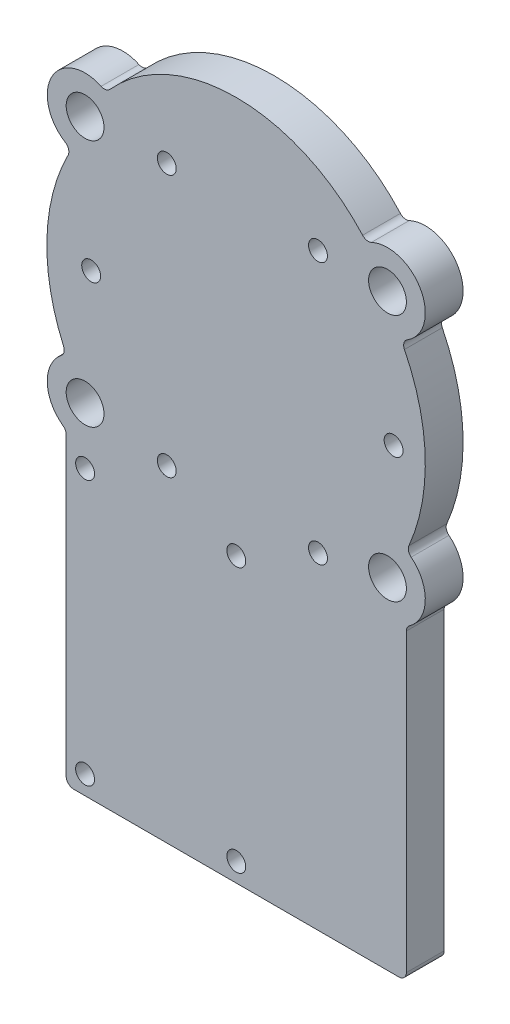
from build123d import *

# Parameters (mm, degrees)
SKETCH1_R           = 0.5
BOSS_EXTRUDE2_DEPTH = 1
FILLET2_R           = 0.2
SKETCH3_R           = 0.25
CUT_EXTRUDE1_DEPTH  = 1
SKETCH4_R           = 0.25
CUT_EXTRUDE2_DEPTH  = 1


with BuildPart() as part:
    # Sketch1 → Boss-Extrude2 (new body)
    with BuildSketch(Plane.XY):
        with BuildLine():
            Line((4.5, -9), (0, -9))
            Line((0, -9), (-4.5, -9))
            Line((-4.5, -9), (-4.5, -0.866025404))
            ThreePointArc((-4.5, -0.866025404), (-5, 0), (-4.5, 0.866025404))
            ThreePointArc((-4.5, 0.866025404), (-5.008977866, 3.264145238), (-4.356520714, 5.627265394))
            ThreePointArc((-4.356520714, 5.627265394), (-4.888888889, 7.01967566), (-3.445948422, 7.394035154))
            ThreePointArc((-3.445948422, 7.394035154), (0, 9), (3.445948422, 7.394035154))
            ThreePointArc((3.445948422, 7.394035154), (4.888888889, 7.01967566), (4.356520714, 5.627265394))
            ThreePointArc((4.356520714, 5.627265394), (4.997611441, 3.263802712), (4.5, 0.866025404))
            ThreePointArc((4.5, 0.866025404), (5, 0), (4.5, -0.866025404))
            Line((4.5, -0.866025404), (4.5, -9))
        make_face()
        with Locations((-4, 0)):
            Circle(SKETCH1_R, mode=Mode.SUBTRACT)
        with Locations((-4, 6.561552813)):
            Circle(SKETCH1_R, mode=Mode.SUBTRACT)
        with Locations(Location((4, 6.561552813, 0), (0, 0, 180))):
            Circle(SKETCH1_R, mode=Mode.SUBTRACT)
        with Locations(Location((4, 0, 0), (0, 0, 180))):
            Circle(SKETCH1_R, mode=Mode.SUBTRACT)
    extrude(amount=BOSS_EXTRUDE2_DEPTH)

    # Fillet2
    fillet2_edges = [part.edges().sort_by_distance(p)[0] for p in [
        (-4.5, -9, 0.5),
        (-4.5, -0.866025404, 0.5),
        (-4.5, 0.866025404, 0.5),
        (-4.356520714, 5.627265394, 0.5),
        (-3.445948422, 7.394035154, 0.5),
        (3.445948422, 7.394035154, 0.5),
        (4.356520714, 5.627265394, 0.5),
        (4.5, 0.866025404, 0.5),
        (4.5, -0.866025404, 0.5),
        (4.5, -9, 0.5),
    ]]
    fillet(fillet2_edges, radius=FILLET2_R)

    # Sketch3 → Cut-Extrude1 (cut)
    with BuildSketch(Plane(origin=(0, 0, 0), x_dir=(-1, 0, 0), z_dir=(0, 0, -1))):
        with Locations((3.839007705, 3.108348927)):
            Circle(SKETCH3_R)
        with Locations((1.839007705, -0.355752688)):
            Circle(SKETCH3_R)
        with Locations((-2.160992295, -0.355752688)):
            Circle(SKETCH3_R)
        with Locations((-4.160992295, 3.108348927)):
            Circle(SKETCH3_R)
        with Locations((-2.160992295, 6.572450542)):
            Circle(SKETCH3_R)
        with Locations((1.839007705, 6.572450542)):
            Circle(SKETCH3_R)
    extrude(amount=-CUT_EXTRUDE1_DEPTH, mode=Mode.SUBTRACT)

    # Sketch4 → Cut-Extrude2 (cut)
    with BuildSketch(Plane(origin=(0, 0, 0), x_dir=(-1, 0, 0), z_dir=(0, 0, -1))):
        with Locations((4, -1.5)):
            Circle(SKETCH4_R)
        with Locations((4, -8.5)):
            Circle(SKETCH4_R)
        with Locations((0, -1.5)):
            Circle(SKETCH4_R)
        with Locations((0, -8.5)):
            Circle(SKETCH4_R)
    extrude(amount=-CUT_EXTRUDE2_DEPTH, mode=Mode.SUBTRACT)


solid = part.part
